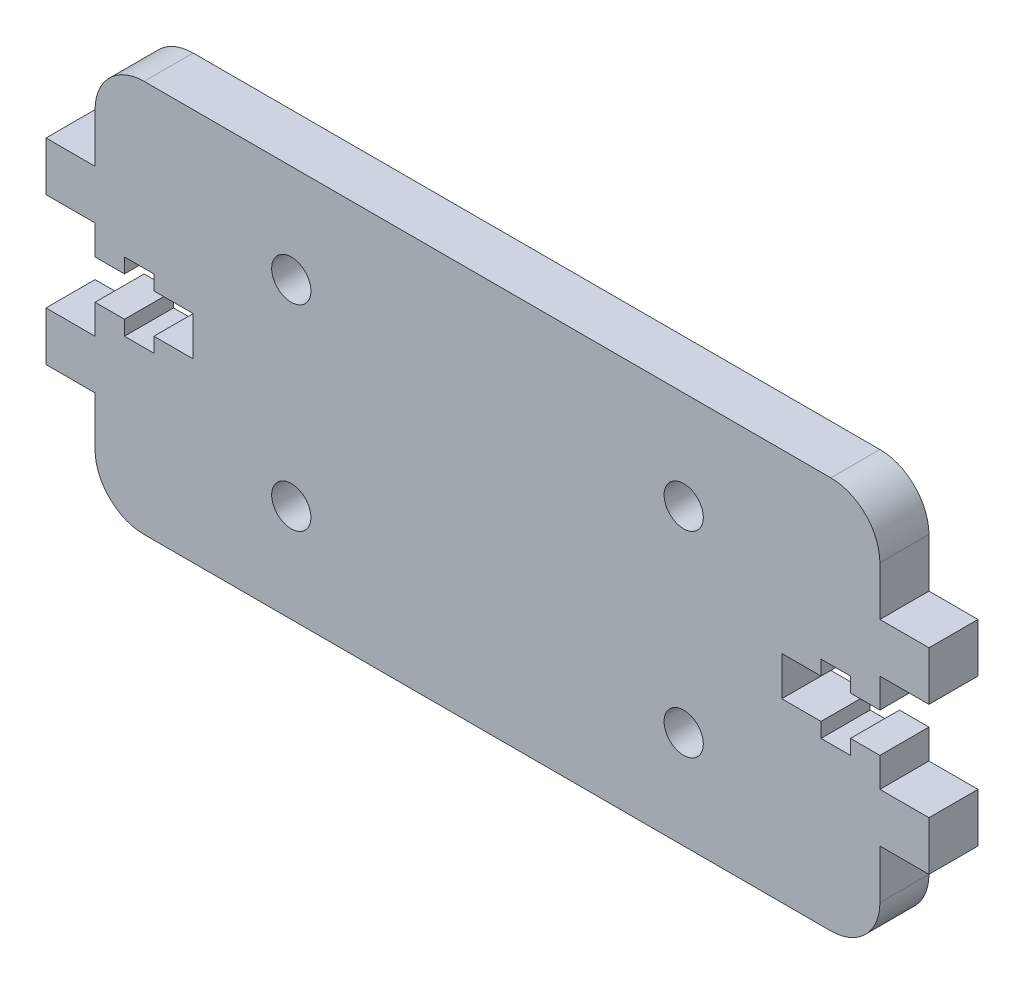
from build123d import *

# Parameters (mm, degrees)
ESQUISSE1_R        = 2
BOSS_EXTRU_1_DEPTH = 5
CONG_1_R           = 5


with BuildPart() as part:
    # Esquisse1 → Boss.-Extru.1 (new body)
    with BuildSketch(Plane.XY):
        Polygon((-40, 0), (40, 0), (40, 10), (45, 10), (45, 15), (40, 15), (40, 18), (37, 18), (37, 16.5), (34, 16.5), (34, 18), (30, 18), (30, 22), (34, 22), (34, 23.5), (37, 23.5), (37, 22), (40, 22), (40, 25), (45, 25), (45, 30), (40, 30), (40, 40), (-40, 40), (-40, 30), (-45, 30), (-45, 25), (-40, 25), (-40, 22), (-37, 22), (-37, 23.5), (-34, 23.5), (-34, 22), (-30, 22), (-30, 18), (-34, 18), (-34, 16.5), (-37, 16.5), (-37, 18), (-40, 18), (-40, 15), (-45, 15), (-45, 10), (-40, 10), align=None)
        with Locations((20, 30)):
            Circle(ESQUISSE1_R, mode=Mode.SUBTRACT)
        with Locations((-20, 30)):
            Circle(ESQUISSE1_R, mode=Mode.SUBTRACT)
        with Locations((-20, 10)):
            Circle(ESQUISSE1_R, mode=Mode.SUBTRACT)
        with Locations((20, 10)):
            Circle(ESQUISSE1_R, mode=Mode.SUBTRACT)
    extrude(amount=BOSS_EXTRU_1_DEPTH)

    # Congé1
    cong_1_edges = [part.edges().sort_by_distance(p)[0] for p in [
        (40, 0, 2.5),
        (-40, 0, 2.5),
        (-40, 40, 2.5),
        (40, 40, 2.5),
    ]]
    fillet(cong_1_edges, radius=CONG_1_R)


solid = part.part
